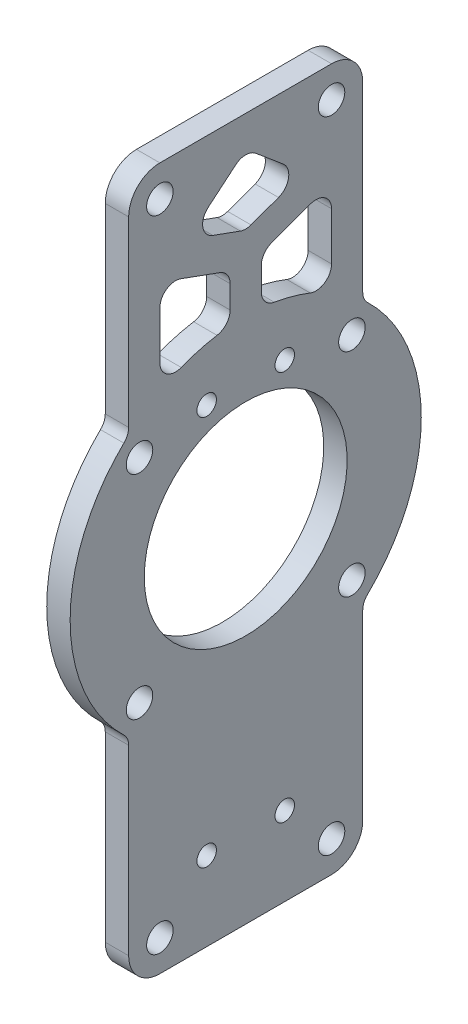
from build123d import *

# Parameters (mm, degrees)
SKETCH_1_W          = 3
SKETCH_1_H          = 30
EXTRUDE_1_DEPTH     = 90
SKETCH_2_R          = 22.5
EXTRUDE_2_DEPTH     = 3
SKETCH_3_R          = 13
CUT_EXTRUDE_1_DEPTH = 98.546142927
HOLE_WIZARD_M31_D   = 3.4
HOLE_WIZARD_M32_D   = 3.4
FILLET_1_R          = 4
M3X0_51_D           = 2.5
CUT_EXTRUDE_2_DEPTH = 98.546142927
FILLET_2_R          = 2


with BuildPart() as part:
    # Эскиз1 → Бобышка-Вытянуть1 (new body)
    with BuildSketch(Plane(origin=(0, 0, 0), x_dir=(1, 0, 0), z_dir=(0, 1, 0))):
        with Locations((1.5, -15)):
            Rectangle(SKETCH_1_W, SKETCH_1_H)
    extrude(amount=EXTRUDE_1_DEPTH)

    # Эскиз2 → Бобышка-Вытянуть2 (add)
    with BuildSketch(Plane.ZY):
        with Locations((15, 45)):
            Circle(SKETCH_2_R)
    extrude(amount=-EXTRUDE_2_DEPTH)

    # Эскиз3 → Вырез-Вытянуть1 (cut, through all)
    with BuildSketch(Plane.ZY):
        with Locations((15, 45)):
            Circle(SKETCH_3_R)
    extrude(amount=-CUT_EXTRUDE_1_DEPTH, mode=Mode.SUBTRACT)

    # Отверстие с зазором M31 (through all)
    with Locations(Plane(origin=(3, -25.024735225, 7.262908886), x_dir=(0, 0, 1), z_dir=(1, 0, 0))):
        with Locations((21.348896652, -83.636540763), (-5.874714424, -83.636540763), (-5.874714424, -56.412929688), (21.348896652, -56.412929688)):
            Hole(HOLE_WIZARD_M31_D / 2)

    # Отверстие с зазором M32 (through all)
    with Locations(Plane(origin=(3, 0, 0), x_dir=(0, 0, -1), z_dir=(1, 0, 0))):
        with Locations((-26, 86), (-4, 86), (-4, 4), (-26, 4)):
            Hole(HOLE_WIZARD_M32_D / 2)

    # Скругление1
    fillet_1_edges = [part.edges().sort_by_distance(p)[0] for p in [
        (1.5, 90, 0),
        (1.5, 0, 0),
        (1.5, 0, 30),
        (1.5, 90, 30),
    ]]
    fillet(fillet_1_edges, radius=FILLET_1_R)

    # Отверстие обработанное метчиком M3x0.51 (through all)
    with Locations(Plane.ZY):
        with Locations((10, 60.12), (20, 60.12), (10, 10.12), (20, 10.12)):
            Hole(M3X0_51_D / 2)

    # Эскиз14 → Вырез-Вытянуть2 (cut, through all)
    with BuildSketch(Plane.ZY):
        with BuildLine():
            Line((13, 73.494171949), (13, 67.410934831))
            ThreePointArc((13, 67.410934831), (8.352708916, 66.495662847), (4, 64.627786426))
            Line((4, 64.627786426), (4, 76.769904057))
            Line((4, 76.769904057), (13, 73.494171949))
        make_face()
        with BuildLine():
            Line((17, 73.494171949), (17, 67.410934831))
            ThreePointArc((17, 67.410934831), (21.647291084, 66.495662847), (26, 64.627786426))
            Line((26, 64.627786426), (26, 76.769904057))
            Line((26, 76.769904057), (17, 73.494171949))
        make_face()
        Polygon((7.538207724, 79.738812853), (15, 77.02294257), (22.461792276, 79.738812853), (15, 86), align=None)
    extrude(amount=-CUT_EXTRUDE_2_DEPTH, mode=Mode.SUBTRACT)

    # Скругление2
    fillet_2_edges = [part.edges().sort_by_distance(p)[0] for p in [
        (1.5, 67.410934831, 13),
        (1.5, 64.627786426, 4),
        (1.5, 76.769904057, 4),
        (1.5, 73.494171949, 13),
        (1.5, 28.229490169, 0),
        (1.5, 61.770509831, 0),
        (1.5, 64.627786426, 26),
        (1.5, 67.410934831, 17),
        (1.5, 73.494171949, 17),
        (1.5, 76.769904057, 26),
        (1.5, 79.738812853, 7.538207724),
        (1.5, 86, 15),
        (1.5, 79.738812853, 22.461792276),
        (1.5, 77.02294257, 15),
        (1.5, 28.229490169, 30),
        (1.5, 61.770509831, 30),
    ]]
    fillet(fillet_2_edges, radius=FILLET_2_R)


solid = part.part
